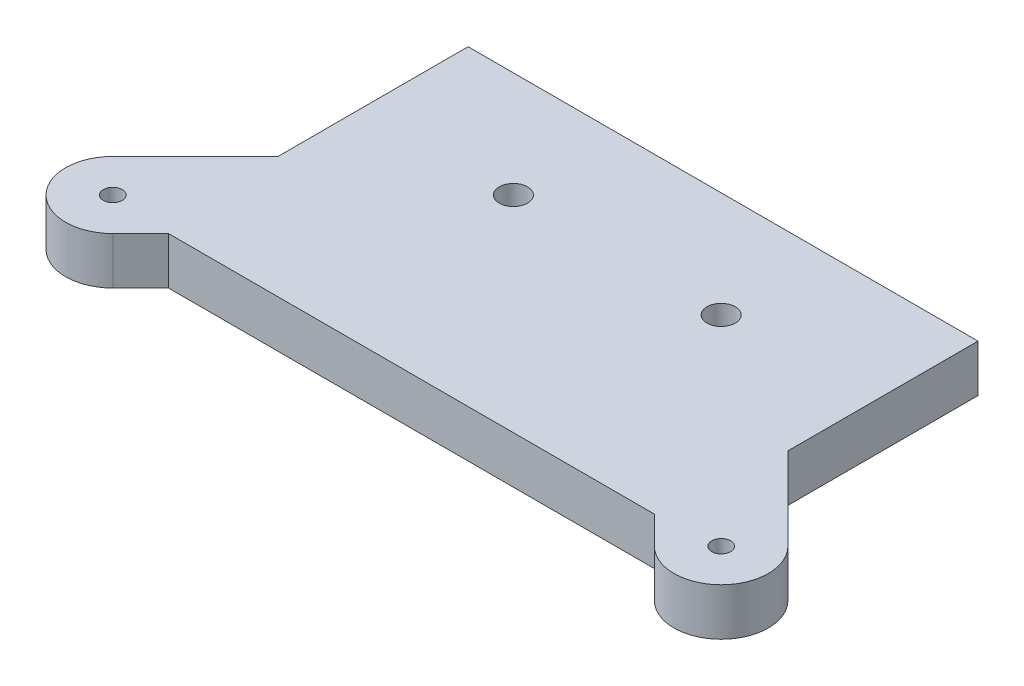
from build123d import *

# Parameters (mm, degrees)
SKETCH1_W           = 54
SKETCH1_H           = 33
BOSS_EXTRUDE1_DEPTH = 5
SKETCH4_R           = 1
BOSS_EXTRUDE2_DEPTH = 5
SKETCH6_R           = 1.5
CUT_EXTRUDE1_DEPTH  = 5


with BuildPart() as part:
    # Sketch1 → Boss-Extrude1 (new body)
    with BuildSketch(Plane(origin=(0, 0, 0), x_dir=(1, 0, 0), z_dir=(0, 1, 0))):
        with Locations((27, 16.5)):
            Rectangle(SKETCH1_W, SKETCH1_H)
    extrude(amount=BOSS_EXTRUDE1_DEPTH)

    # Sketch4 → Boss-Extrude2 (add)
    # profile 1 of 2: a face of its own
    with BuildSketch(Plane.XZ):
        with BuildLine():
            Line((62.748737342, -4.12233047), (54, -12.871067812))
            Line((54, -12.871067812), (54, 0))
            Line((54, 0), (52.728932188, 0))
            Line((52.728932188, 0), (55.67766953, 2.948737342))
            ThreePointArc((55.67766953, 2.948737342), (62.748737342, 2.948737342), (62.748737342, -4.12233047))
        make_face()
        with Locations(Location((59.213203436, -0.586796564, 0), (0, 0, 270))):
            Circle(SKETCH4_R, mode=Mode.SUBTRACT)
    # profile 2 of 2: a face of its own
    with BuildSketch(Plane.XZ):
        with BuildLine():
            Line((-8.748737342, -4.12233047), (0, -12.871067812))
            Line((0, -12.871067812), (0, 0))
            Line((0, 0), (1.271067812, 0))
            Line((1.271067812, 0), (-1.67766953, 2.948737342))
            ThreePointArc((-1.67766953, 2.948737342), (-8.748737342, 2.948737342), (-8.748737342, -4.12233047))
        make_face()
        with Locations(Location((-5.213203436, -0.586796564, 0), (0, 0, 270))):
            Circle(SKETCH4_R, mode=Mode.SUBTRACT)
    extrude(amount=-BOSS_EXTRUDE2_DEPTH)

    # Sketch6 → Cut-Extrude1 (cut)
    with BuildSketch(Plane.XZ):
        with Locations(Location((38, -21.8, 0), (0, 0, 270))):
            Circle(SKETCH6_R)
        with Locations(Location((16, -21.8, 0), (0, 0, 270))):
            Circle(SKETCH6_R)
    extrude(amount=-CUT_EXTRUDE1_DEPTH, mode=Mode.SUBTRACT)


solid = part.part
